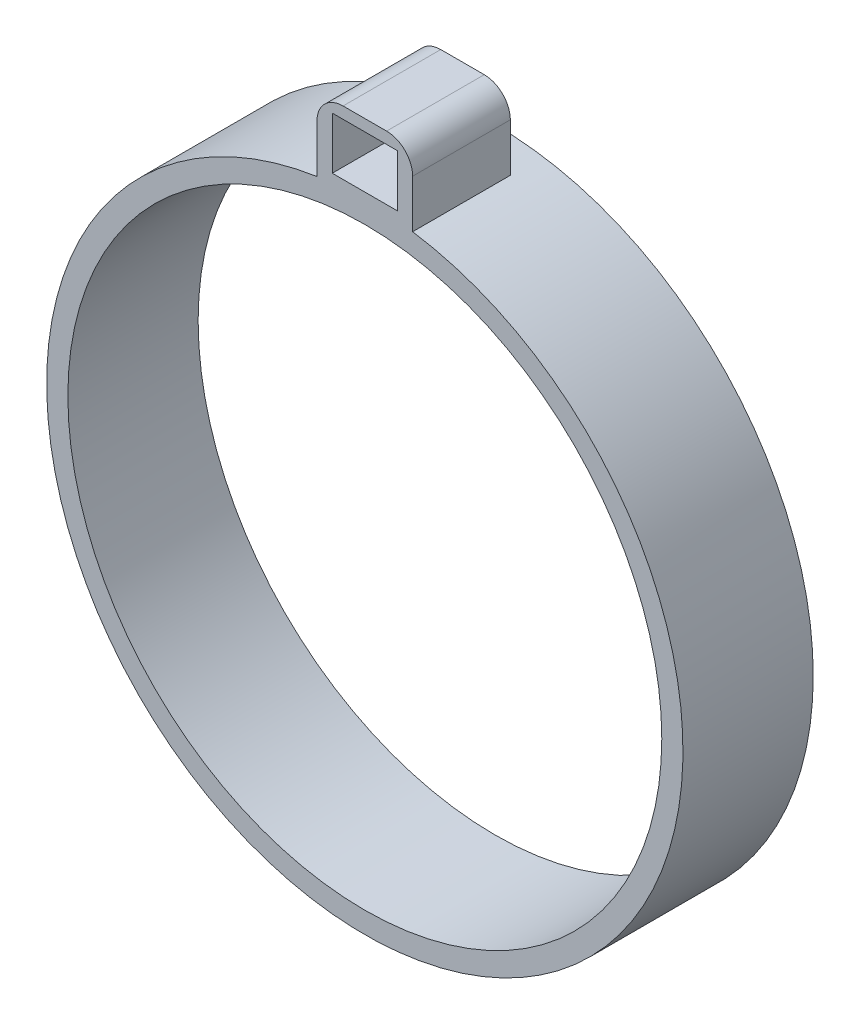
from build123d import *

# Parameters (mm, degrees)
SKETCH1_R           = 48.846646741
SKETCH1_R_2         = 45.593095846
BOSS_EXTRUDE1_DEPTH = 10
SKETCH2_W           = 14.682281382
SKETCH2_H           = 11.549997154
SKETCH2_W_2         = 10
SKETCH2_H_2         = 8
BOSS_EXTRUDE2_DEPTH = 15
FILLET1_R           = 4


with BuildPart() as part:
    # Sketch1 → Boss-Extrude1 (new, symmetric)
    with BuildSketch(Plane.XY):
        Circle(SKETCH1_R)
        Circle(SKETCH1_R_2, mode=Mode.SUBTRACT)
    extrude(amount=BOSS_EXTRUDE1_DEPTH, both=True)

    # Sketch2 → Boss-Extrude2 (add)
    with BuildSketch(Plane.XY.offset(10)):
        with Locations((0, 53.899768405)):
            Rectangle(SKETCH2_W, SKETCH2_H)
        with Locations((0, 53.899768405)):
            Rectangle(SKETCH2_W_2, SKETCH2_H_2, mode=Mode.SUBTRACT)
    extrude(amount=-BOSS_EXTRUDE2_DEPTH)

    # Fillet1
    fillet1_edges = [part.edges().sort_by_distance(p)[0] for p in [
        (7.341140691, 59.674766982, 2.5),
        (-7.341140691, 59.674766982, 2.5),
    ]]
    fillet(fillet1_edges, radius=FILLET1_R)


solid = part.part
